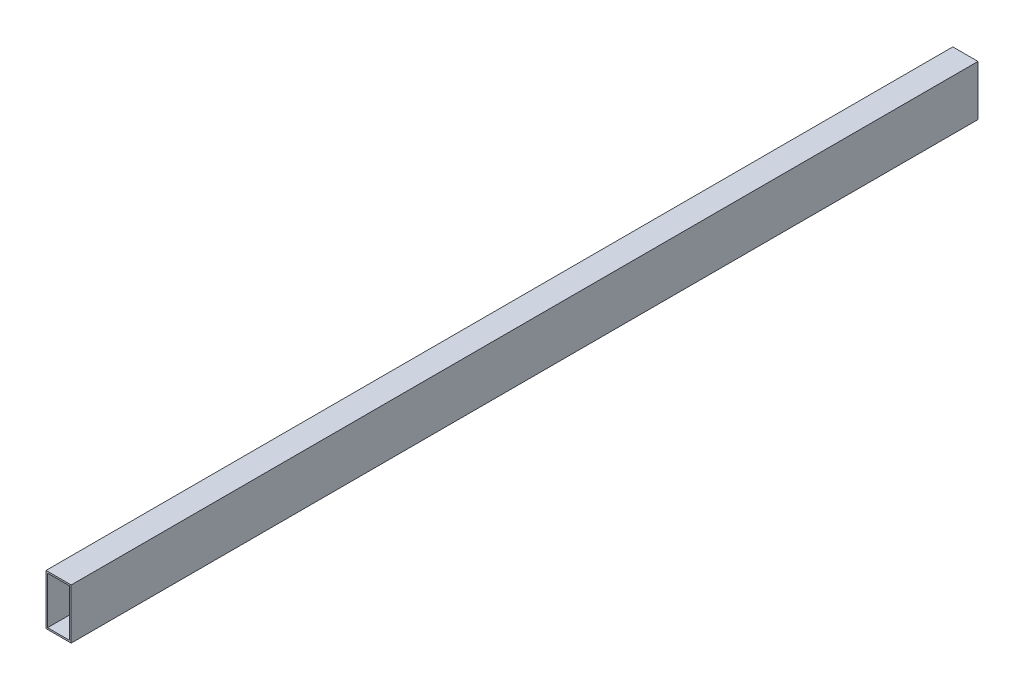
from build123d import *

# Parameters (mm, degrees)
SKETCH1_W           = 25.4
SKETCH1_H           = 50.8
SKETCH1_W_2         = 22.1996
SKETCH1_H_2         = 47.5996
BOSS_EXTRUDE1_DEPTH = 914.4


with BuildPart() as part:
    # Sketch1 → Boss-Extrude1 (new body)
    with BuildSketch(Plane.XY):
        Rectangle(SKETCH1_W, SKETCH1_H)
        Rectangle(SKETCH1_W_2, SKETCH1_H_2, mode=Mode.SUBTRACT)
    extrude(amount=-BOSS_EXTRUDE1_DEPTH)


solid = part.part
